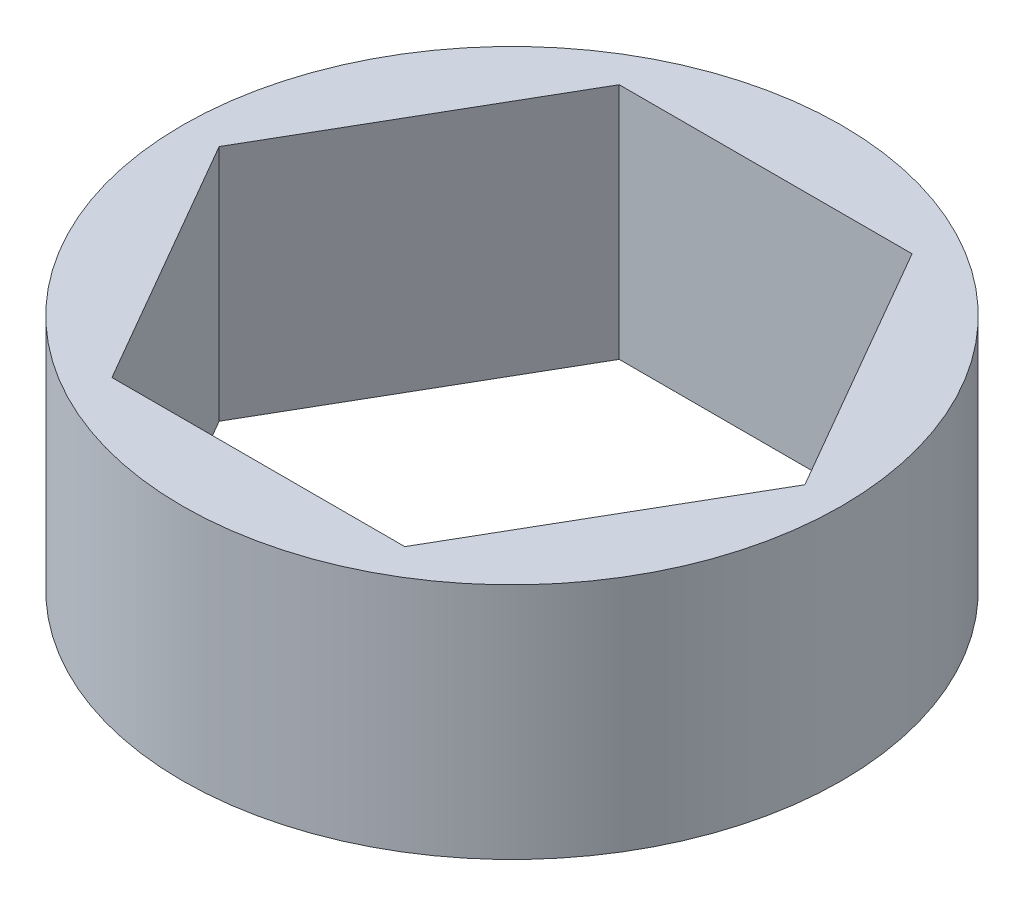
from build123d import *

# Parameters (mm, degrees)
SKETCH1_R           = 8.255
BOSS_EXTRUDE1_DEPTH = 5.9563


with BuildPart() as part:
    # Sketch1 → Boss-Extrude1 (new body)
    with BuildSketch(Plane(origin=(0, 0, 0), x_dir=(1, 0, 0), z_dir=(0, 1, 0))):
        with Locations(Location((0, 0, 0), (0, 0, 270))):
            Circle(SKETCH1_R)
        Polygon((7.332348419, 0), (3.666174209, 6.35), (-3.666174209, 6.35), (-7.332348419, 0), (-3.666174209, -6.35), (3.666174209, -6.35), align=None, mode=Mode.SUBTRACT)
    extrude(amount=BOSS_EXTRUDE1_DEPTH)


solid = part.part
